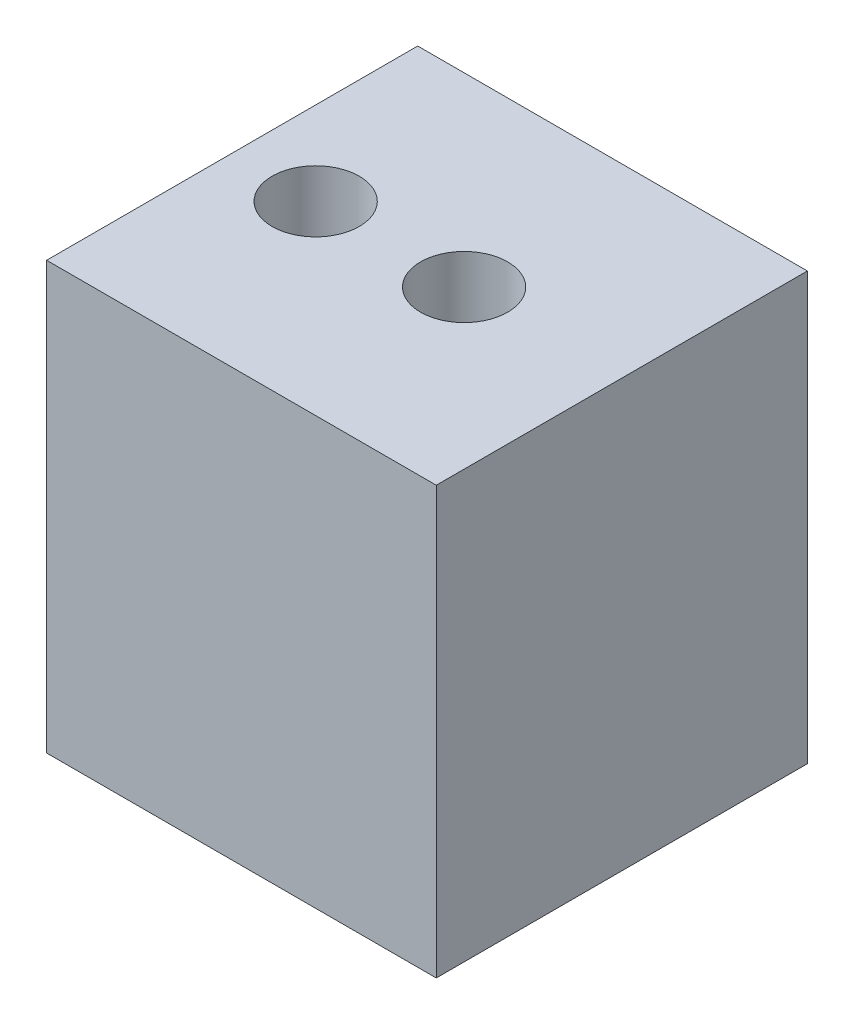
from build123d import *

# Parameters (mm, degrees)
SKETCH1_W           = 21
SKETCH1_H           = 20
SKETCH1_R           = 2.35
BOSS_EXTRUDE1_DEPTH = 23


with BuildPart() as part:
    # Sketch1 → Boss-Extrude1 (new body)
    with BuildSketch(Plane(origin=(0, 0, 0), x_dir=(1, 0, 0), z_dir=(0, 1, 0))):
        Rectangle(SKETCH1_W, SKETCH1_H)
        with Locations(Location((-6, 0, 0), (0, 0, 270))):
            Circle(SKETCH1_R, mode=Mode.SUBTRACT)
        with Locations(Location((2, 0, 0), (0, 0, 270))):
            Circle(SKETCH1_R, mode=Mode.SUBTRACT)
    extrude(amount=BOSS_EXTRUDE1_DEPTH)


solid = part.part
